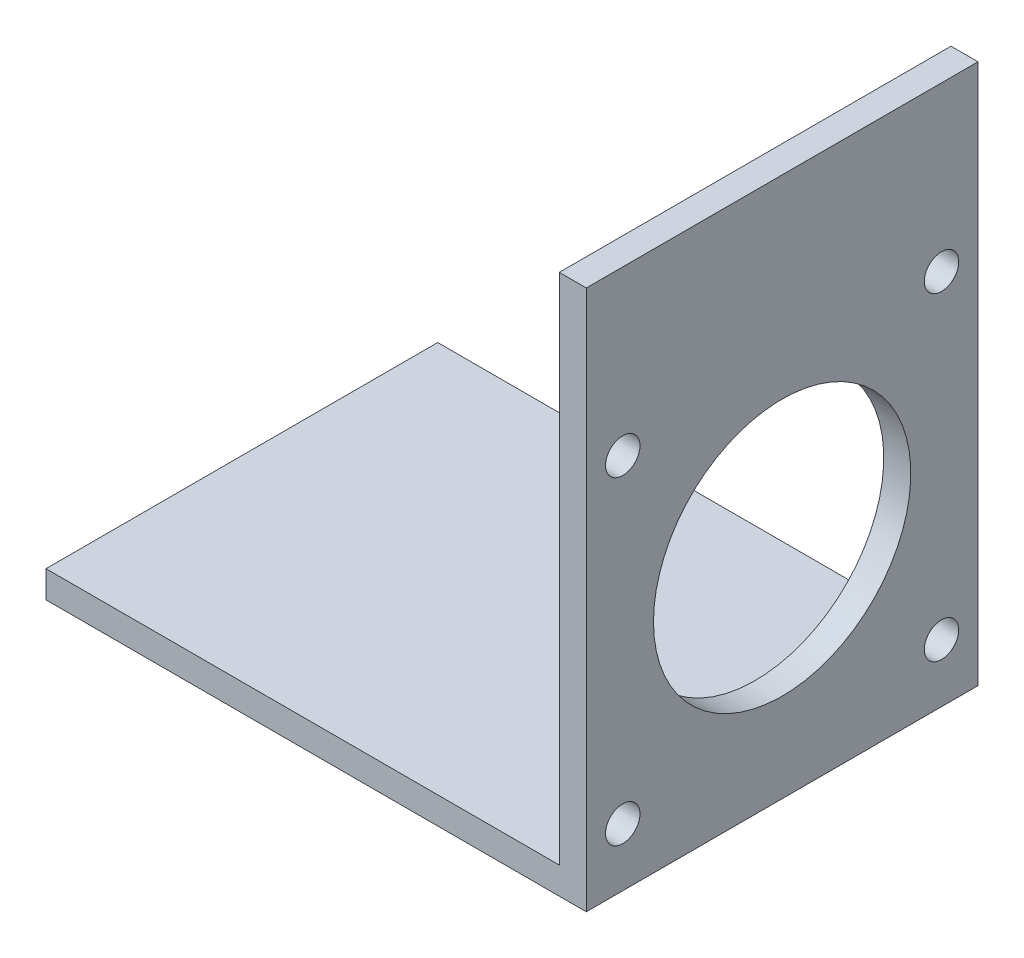
from build123d import *

# Parameters (mm, degrees)
SKETCH1_W           = 80
SKETCH1_H           = 58
BOSS_EXTRUDE1_DEPTH = 4
SKETCH1_3_W         = 4
SKETCH1_3_H         = 58
BOSS_EXTRUDE2_DEPTH = 80
SKETCH3_R           = 2.55
SKETCH3_R_2         = 19.05
CUT_EXTRUDE1_DEPTH  = 80


with BuildPart() as part:
    # Sketch1 → Boss-Extrude1 (new body)
    with BuildSketch(Plane(origin=(0, 0, 0), x_dir=(1, 0, 0), z_dir=(0, 1, 0))):
        with Locations((40, 29)):
            Rectangle(SKETCH1_W, SKETCH1_H)
    extrude(amount=BOSS_EXTRUDE1_DEPTH)

    # Sketch1<3> → Boss-Extrude2 (add)
    with BuildSketch(Plane(origin=(0, 0, 0), x_dir=(1, 0, 0), z_dir=(0, 1, 0))):
        with Locations((78, 29)):
            Rectangle(SKETCH1_3_W, SKETCH1_3_H)
    extrude(amount=BOSS_EXTRUDE2_DEPTH)

    # Sketch3 → Cut-Extrude1 (cut)
    with BuildSketch(Plane.ZY.offset(-76)):
        with Locations((-52.6, 55.8)):
            Circle(SKETCH3_R)
        with Locations((-5.4, 55.8)):
            Circle(SKETCH3_R)
        with Locations((-52.6, 8.6)):
            Circle(SKETCH3_R)
        with Locations((-5.4, 8.6)):
            Circle(SKETCH3_R)
        with Locations((-29, 32.2)):
            Circle(SKETCH3_R_2)
    extrude(amount=-CUT_EXTRUDE1_DEPTH, mode=Mode.SUBTRACT)


solid = part.part
